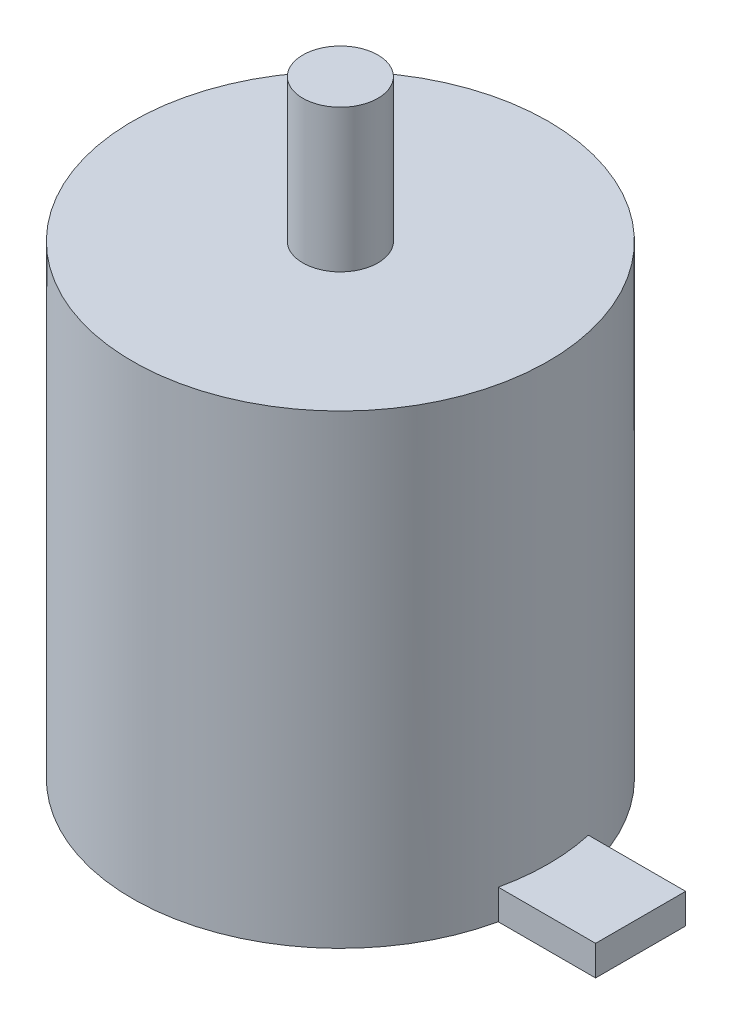
from build123d import *

# Parameters (mm, degrees)
SKETCH_3_R          = 1.25
CUT_EXTRUDE_1_DEPTH = 5
EXTRUDE_1_DEPTH     = 2


with BuildPart() as part:
    # Эскиз2 → Повернуть1 (revolve)
    with BuildSketch(Plane(origin=(0, 0, 0), x_dir=(0, 0, -1), z_dir=(1, 0, 0))):
        Polygon((0, 0), (0, 31), (0, 40.5), (2.5, 40.5), (2.5, 31), (13.85, 31), (13.85, 0), (1.5, 0), (1.5, -2), (0, -2), align=None)
    revolve(axis=Axis((0, 0, 0), (0, 1, 0)))

    # Эскиз3 → Вырез-Вытянуть1 (cut)
    with BuildSketch(Plane.XZ):
        with Locations(Location((5.65685425, 5.65685425, 0), (0, 0, 270))):
            Circle(SKETCH_3_R)
        with Locations(Location((6.717514421, -6.717514421, 0), (0, 0, 270))):
            Circle(SKETCH_3_R)
        with Locations(Location((-6.717514421, 6.717514421, 0), (0, 0, 90))):
            Circle(SKETCH_3_R)
        with Locations(Location((-5.65685425, -5.65685425, 0), (0, 0, 90))):
            Circle(SKETCH_3_R)
    extrude(amount=-CUT_EXTRUDE_1_DEPTH, mode=Mode.SUBTRACT)

    # Эскиз4 → Бобышка-Вытянуть1 (add)
    with BuildSketch(Plane.XZ):
        with BuildLine():
            Line((13.521187078, -3), (13.85, -3))
            Line((13.85, -3), (20, -3))
            Line((20, -3), (20, 3))
            Line((20, 3), (13.521187078, 3))
            ThreePointArc((13.521187078, 3), (13.767551362, 1.50898293), (13.85, 0))
            ThreePointArc((13.85, 0), (13.767551362, -1.50898293), (13.521187078, -3))
        make_face()
    extrude(amount=-EXTRUDE_1_DEPTH)


solid = part.part
